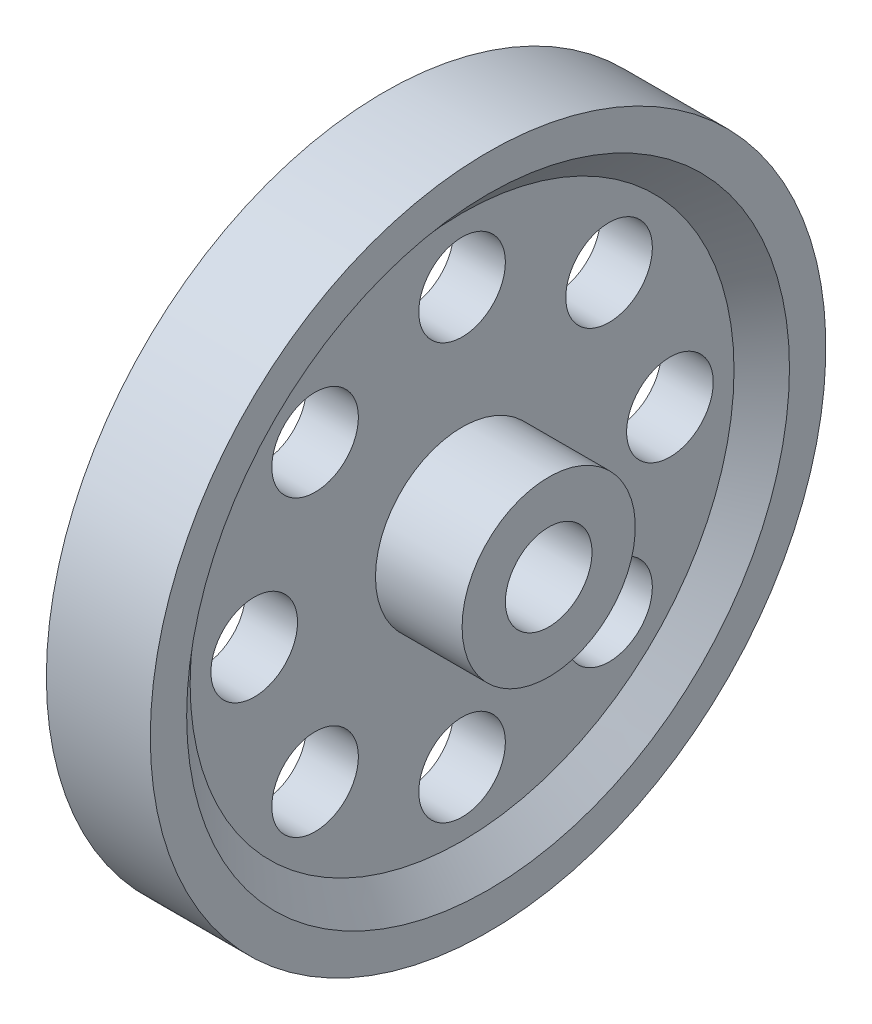
from build123d import *

# Parameters (mm, degrees)
SKETCH2_R          = 2.5
CUT_EXTRUDE1_DEPTH = 29.026772914


with BuildPart() as part:
    # Sketch1 → Revolve1 (revolve)
    with BuildSketch(Plane.XY, mode=Mode.PRIVATE) as revolve1_sk:
        Polygon((0, 7), (0, 2.5), (8, 2.5), (8, 5), (3, 5), (3, 15.7), (4.5, 17.4), (4.5, 19.5), (-1.5, 19.5), (-1.5, 17.4), (0, 15.7), align=None)
        Polygon((-1, 2.5), (0, 2.5), (0, 7), (-1, 6), align=None)
    revolve(revolve1_sk.sketch.rotate(Axis((0, 0, 0), (1, 0, 0)), 90), axis=Axis((0, 0, 0), (1, 0, 0)))

    # Sketch2 → Cut-Extrude1 (cut, through all)
    with BuildSketch(Plane(origin=(3, 0, 0), x_dir=(0, 0, -1), z_dir=(1, 0, 0))):
        with Locations((0, 12)):
            Circle(SKETCH2_R)
        with Locations((8.485281374, 8.485281374)):
            Circle(SKETCH2_R)
        with Locations((12, 0)):
            Circle(SKETCH2_R)
        with Locations((8.485281374, -8.485281374)):
            Circle(SKETCH2_R)
        with Locations((0, -12)):
            Circle(SKETCH2_R)
        with Locations((-8.485281374, -8.485281374)):
            Circle(SKETCH2_R)
        with Locations((-12, 0)):
            Circle(SKETCH2_R)
        with Locations((-8.485281374, 8.485281374)):
            Circle(SKETCH2_R)
    extrude(amount=-CUT_EXTRUDE1_DEPTH, mode=Mode.SUBTRACT)


solid = part.part
